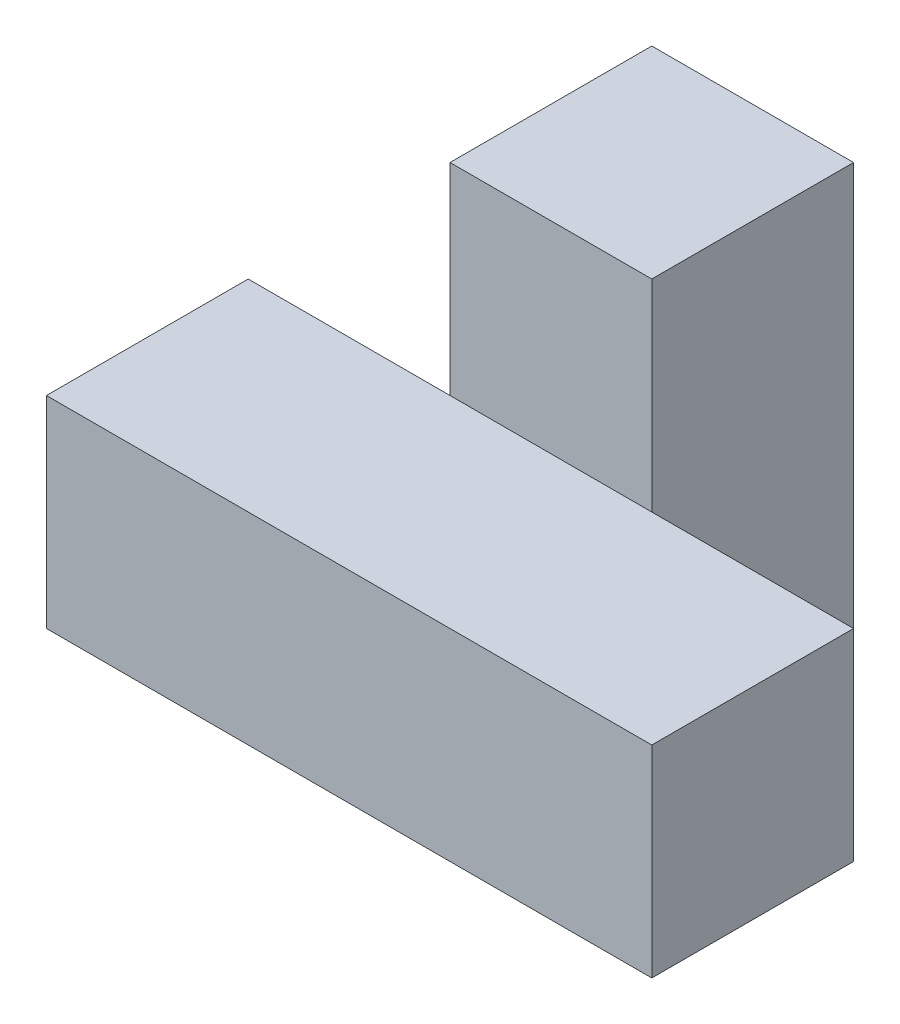
from build123d import *

# Parameters (mm, degrees)
BOSS_EXTRUDE2_DEPTH = 25.4
SKETCH3_W           = 25.4
SKETCH3_H           = 25.4
BOSS_EXTRUDE3_DEPTH = 25.4


with BuildPart() as part:
    # Sketch2 → Boss-Extrude2 (new body)
    with BuildSketch(Plane(origin=(0, 0, 0), x_dir=(1, 0, 0), z_dir=(0, 1, 0))):
        Polygon((0, 0), (25.4, 0), (25.4, 25.4), (50.8, 25.4), (50.8, 0), (76.2, 0), (76.2, -25.4), (0, -25.4), align=None)
    extrude(amount=BOSS_EXTRUDE2_DEPTH)

    # Sketch3 → Boss-Extrude3 (add)
    with BuildSketch(Plane(origin=(0, 25.4, 0), x_dir=(1, 0, 0), z_dir=(0, 1, 0))):
        with Locations((38.1, 12.7)):
            Rectangle(SKETCH3_W, SKETCH3_H)
    extrude(amount=BOSS_EXTRUDE3_DEPTH)


solid = part.part
